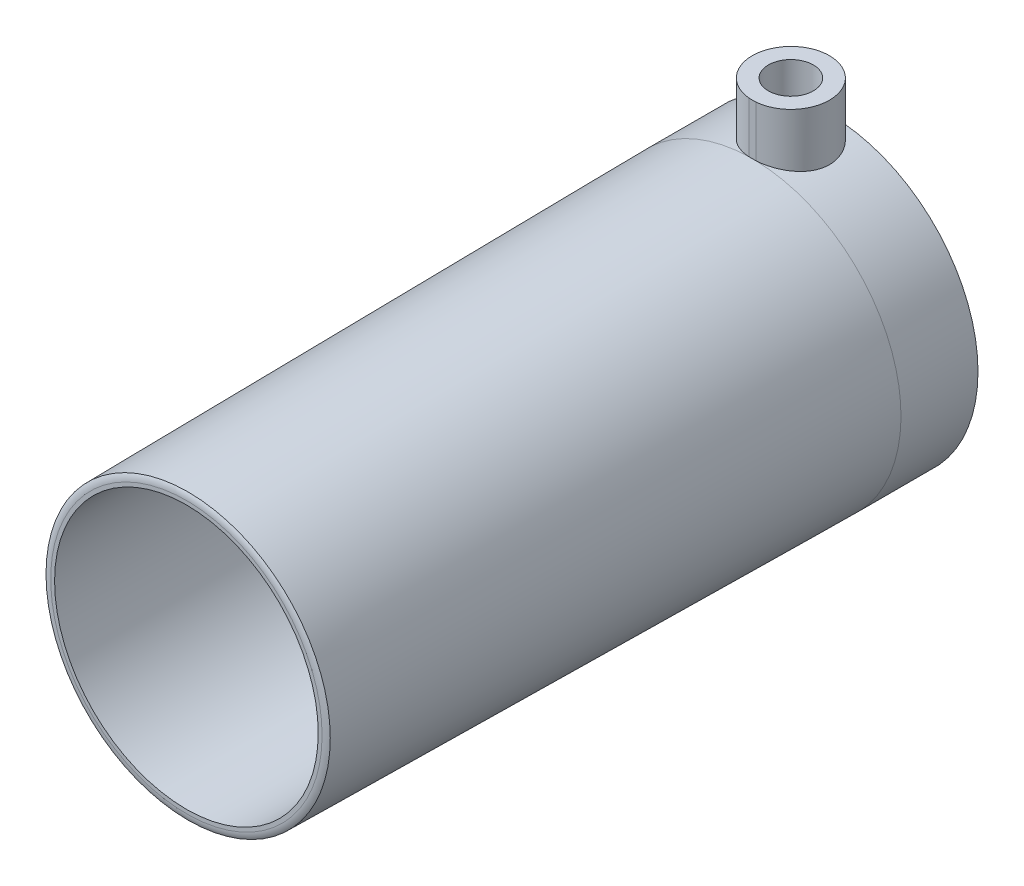
from build123d import *
from build123d.topology import SkipClean

# Parameters (mm, degrees)
SKETCH_1_R          = 23.1
SKETCH_1_R_2        = 20.5
EXTRUDE_1_DEPTH     = 100
SKETCH_2_R          = 6
EXTRUDE_2_DEPTH     = 10
SKETCH_3_R          = 3.5
CUT_EXTRUDE_1_DEPTH = 20
FILLET_1_R          = 2


with BuildPart() as part:
    # 草图1 → 凸台-拉伸1 (new body)
    with BuildSketch(Plane.XY):
        with Locations(Location((0, 0, 0), (0, 0, 180))):
            Circle(SKETCH_1_R)
        with Locations(Location((0, 0, 0), (0, 0, 180))):
            Circle(SKETCH_1_R_2, mode=Mode.SUBTRACT)
    extrude(amount=EXTRUDE_1_DEPTH)

    # 草图2 → 凸台-拉伸2 (add)
    with BuildSketch(Plane(origin=(0, 21, 0), x_dir=(1, 0, 0), z_dir=(0, 1, 0))):
        with Locations(Location((0, -6, 0), (0, 0, 270))):
            Circle(SKETCH_2_R)
    extrude(amount=EXTRUDE_2_DEPTH)

    # 草图3 → 切除-拉伸1 (cut)
    with BuildSketch(Plane(origin=(0, 31, 0), x_dir=(1, 0, 0), z_dir=(0, 1, 0))):
        with Locations(Location((0, -6, 0), (0, 0, 270))):
            Circle(SKETCH_3_R)
    extrude(amount=-CUT_EXTRUDE_1_DEPTH, mode=Mode.SUBTRACT)

    # 圆角1
    fillet_1_edges = [part.edges().sort_by_distance(p)[0] for p in [
        (23.1, 0, 100),
    ]]
    fillet(fillet_1_edges, radius=FILLET_1_R)

    # 草图4 → 切除-旋转1 (revolve, cut)
    with SkipClean():  # the faces are left unmerged after this step: merging them gives an invalid solid
        with BuildSketch(Plane(origin=(0, 0, 0), x_dir=(1, 0, 0), z_dir=(0, 1, 0))):
            Polygon((23.1, -11.974371638), (22.1, -100), (36.719914386, -100), (36.719914386, -11.974371638), align=None)
        revolve(axis=Axis((0, 0, 100), (0, 0, -1)), mode=Mode.SUBTRACT)


solid = part.part
